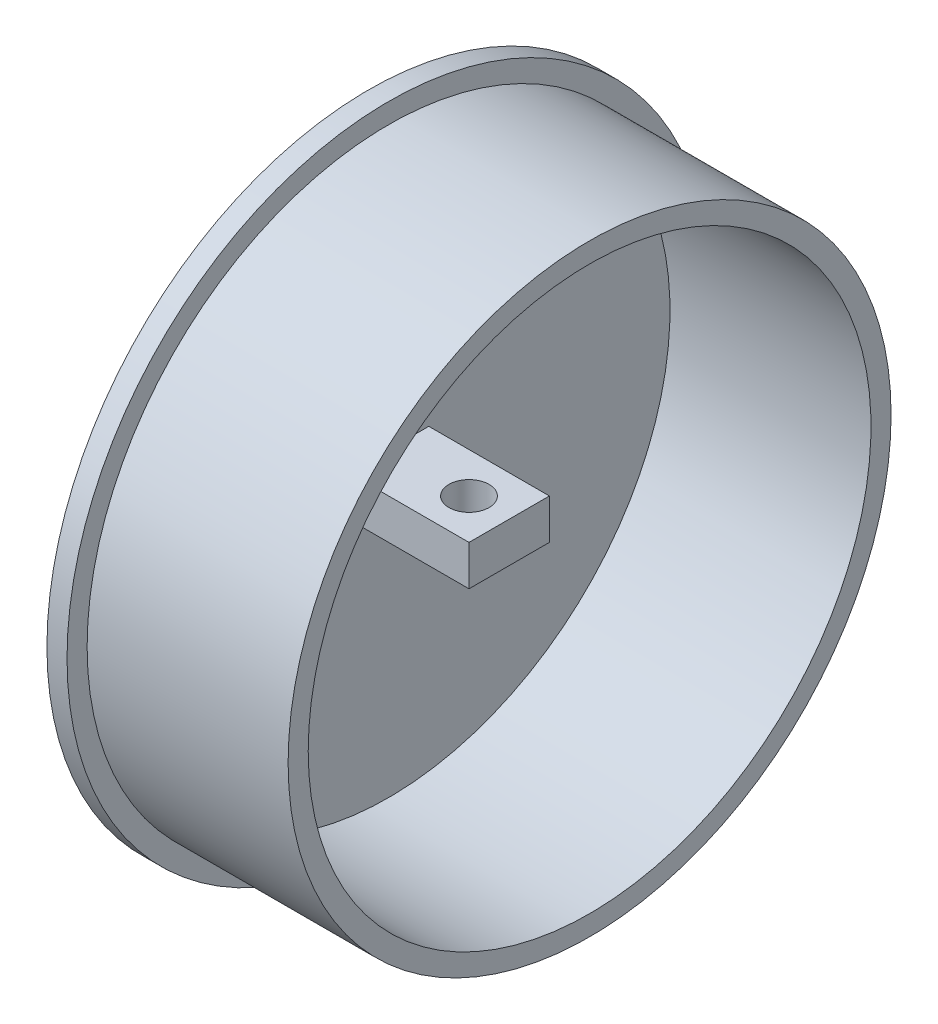
from build123d import *

# Parameters (mm, degrees)
SKIZZE1_W                       = 5
SKIZZE1_H                       = 80
SKIZZE1_W_2                     = 50
SKIZZE1_H_2                     = 5
SKIZZE2_W                       = 20
SKIZZE2_H                       = 10
AUFSATZ_LINEAR_AUSTRAGEN1_DEPTH = 30
SKIZZE3_R                       = 5
SCHNITT_LINEAR_AUSTRAGEN1_DEPTH = 30


with BuildPart() as part:
    # Skizze1 → Rotation1 (revolve)
    with BuildSketch(Plane.XY, mode=Mode.PRIVATE) as rotation1_sk:
        with Locations((-2.5, 40)):
            Rectangle(SKIZZE1_W, SKIZZE1_H)
        with Locations((25, 72.5)):
            Rectangle(SKIZZE1_W_2, SKIZZE1_H_2)
    revolve(rotation1_sk.sketch.rotate(Axis((0, 0, 0), (1, 0, 0)), 90), axis=Axis((0, 0, 0), (1, 0, 0)))

    # Skizze2 → Aufsatz-Linear austragen1 (add)
    with BuildSketch(Plane(origin=(0, 0, 0), x_dir=(0, 0, -1), z_dir=(1, 0, 0))):
        Rectangle(SKIZZE2_W, SKIZZE2_H)
    extrude(amount=AUFSATZ_LINEAR_AUSTRAGEN1_DEPTH)

    # Skizze3 → Schnitt-Linear austragen1 (cut)
    with BuildSketch(Plane.XZ.offset(5)):
        with Locations(Location((20, 0, 0), (0, 0, 270))):
            Circle(SKIZZE3_R)
    extrude(amount=-SCHNITT_LINEAR_AUSTRAGEN1_DEPTH, mode=Mode.SUBTRACT)


solid = part.part
